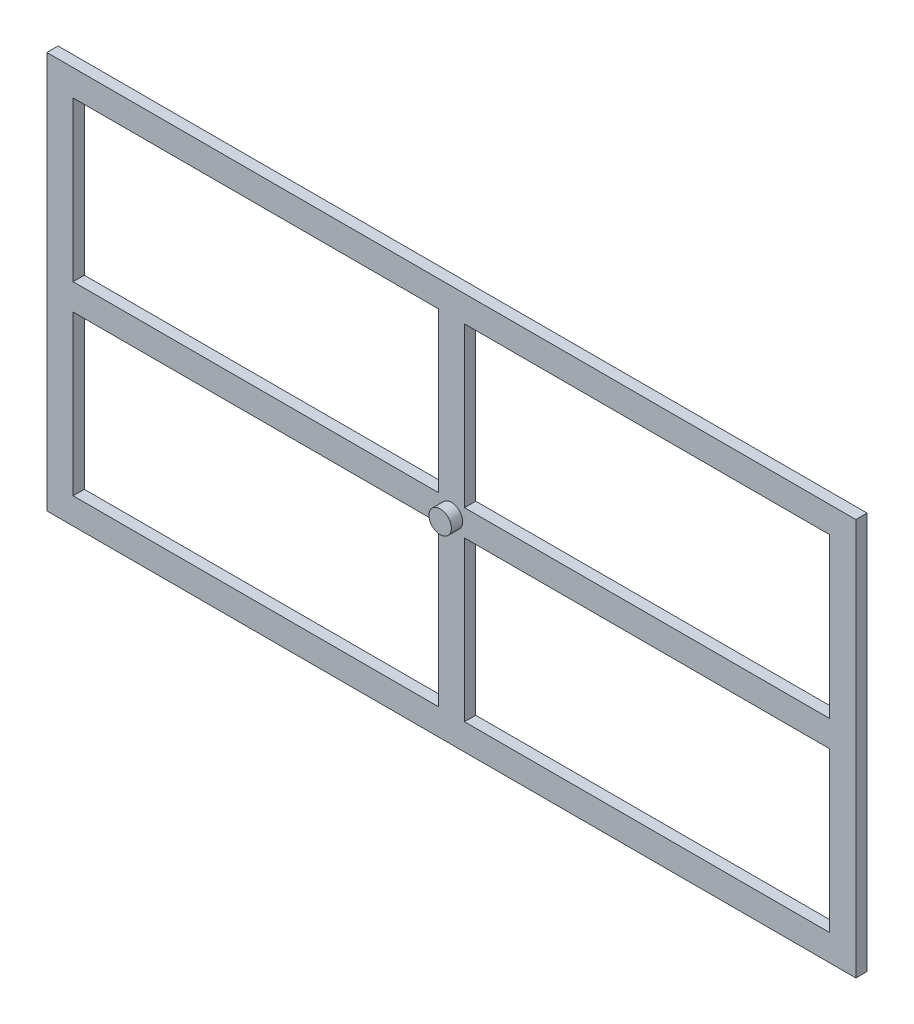
from build123d import *

# Parameters (mm, degrees)
ESBO_O1_W                = 216
ESBO_O1_H                = 106
ESBO_O1_W_2              = 97.5
ESBO_O1_H_2              = 42.5
RESSALTO_EXTRUS_O1_DEPTH = 3
ESBO_O2_R                = 3
RESSALTO_EXTRUS_O2_DEPTH = 3
ESBO_O3_R                = 2
CORTE_EXTRUS_O1_DEPTH    = 1


with BuildPart() as part:
    # Esboço1 → Ressalto-extrusão1 (new body)
    with BuildSketch(Plane.XY):
        with Locations((-24.354637835, -10.294366601)):
            Rectangle(ESBO_O1_W, ESBO_O1_H)
        with Locations((-76.604637835, 14.455633399)):
            Rectangle(ESBO_O1_W_2, ESBO_O1_H_2, mode=Mode.SUBTRACT)
        with Locations((27.895362165, 14.455633399)):
            Rectangle(ESBO_O1_W_2, ESBO_O1_H_2, mode=Mode.SUBTRACT)
        with Locations((27.895362165, -35.044366601)):
            Rectangle(ESBO_O1_W_2, ESBO_O1_H_2, mode=Mode.SUBTRACT)
        with Locations((-76.604637835, -35.044366601)):
            Rectangle(ESBO_O1_W_2, ESBO_O1_H_2, mode=Mode.SUBTRACT)
    extrude(amount=RESSALTO_EXTRUS_O1_DEPTH)

    # Esboço2 → Ressalto-extrusão2 (add)
    with BuildSketch(Plane.XY.offset(3)):
        with Locations((-24.354637835, -10.294366601)):
            Circle(ESBO_O2_R)
    extrude(amount=RESSALTO_EXTRUS_O2_DEPTH)

    # Esboço3 → Corte-extrusão1 (cut)
    with BuildSketch(Plane(origin=(0, 0, 0), x_dir=(-1, 0, 0), z_dir=(0, 0, -1))):
        with Locations((-79.645362165, 38.705633399)):
            Circle(ESBO_O3_R)
        with Locations((128.354637835, 38.705633399)):
            Circle(ESBO_O3_R)
        with Locations((-79.645362165, -59.294366601)):
            Circle(ESBO_O3_R)
        with Locations((128.354637835, -59.294366601)):
            Circle(ESBO_O3_R)
    extrude(amount=-CORTE_EXTRUS_O1_DEPTH, mode=Mode.SUBTRACT)


solid = part.part
